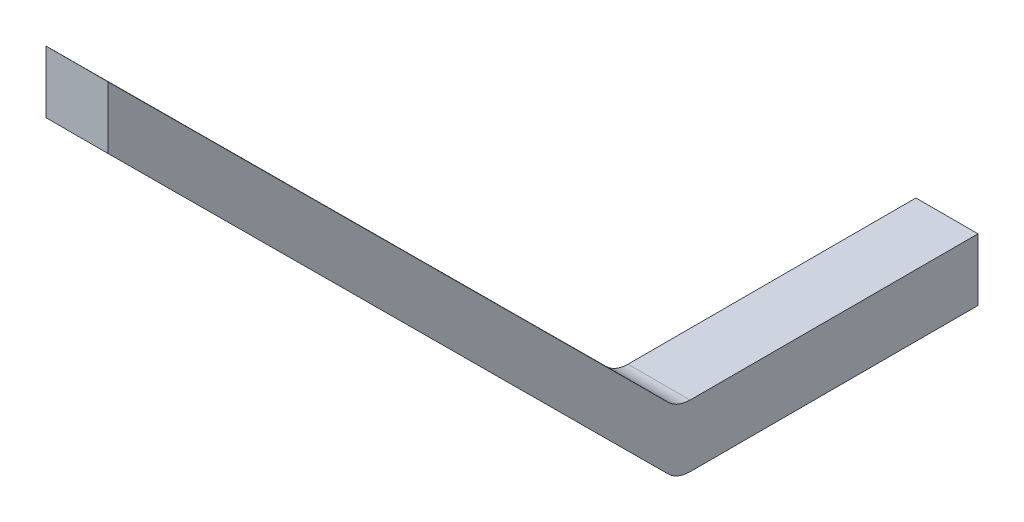
from build123d import *

# Parameters (mm, degrees)
BOSS_EXTRUDE1_DEPTH = 6
FILLET1_R           = 3


with BuildPart() as part:
    # Sketch1 → Boss-Extrude1 (new body)
    with BuildSketch(Plane(origin=(0, 0, 0), x_dir=(0, 0, -1), z_dir=(1, 0, 0))):
        Polygon((0, 0), (-29.067447869, 0), (-84.067447869, 54.75), (-84.067447869, 60.75), (-29.067447869, 6), (0, 6), align=None)
    extrude(amount=BOSS_EXTRUDE1_DEPTH)

    # Fillet1
    fillet1_edges = [part.edges().sort_by_distance(p)[0] for p in [
        (3, 0, 29.067447869),
        (3, 6, 29.067447869),
    ]]
    fillet(fillet1_edges, radius=FILLET1_R)


solid = part.part
